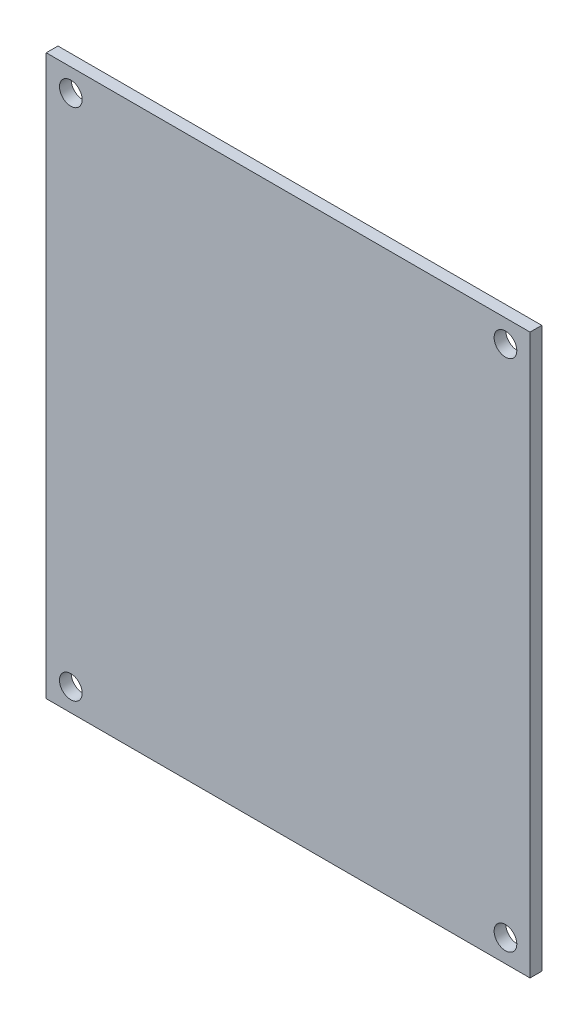
from build123d import *

# Parameters (mm, degrees)
SKETCH_1_W          = 64
SKETCH_1_H          = 74
EXTRUDE_1_DEPTH     = 1.55
SKETCH_2_R          = 1.5
CUT_EXTRUDE_1_DEPTH = 1.55


with BuildPart() as part:
    # 草图1 → 凸台-拉伸1 (new body)
    with BuildSketch(Plane.XY):
        Rectangle(SKETCH_1_W, SKETCH_1_H)
    extrude(amount=EXTRUDE_1_DEPTH)

    # 草图2 → 切除-拉伸1 (cut)
    with BuildSketch(Plane.XY.offset(1.55)):
        with Locations((-28.75, 34)):
            Circle(SKETCH_2_R)
        with Locations((28.75, 34)):
            Circle(SKETCH_2_R)
        with Locations((28.75, -34)):
            Circle(SKETCH_2_R)
        with Locations((-28.75, -34)):
            Circle(SKETCH_2_R)
    extrude(amount=-CUT_EXTRUDE_1_DEPTH, mode=Mode.SUBTRACT)


solid = part.part
